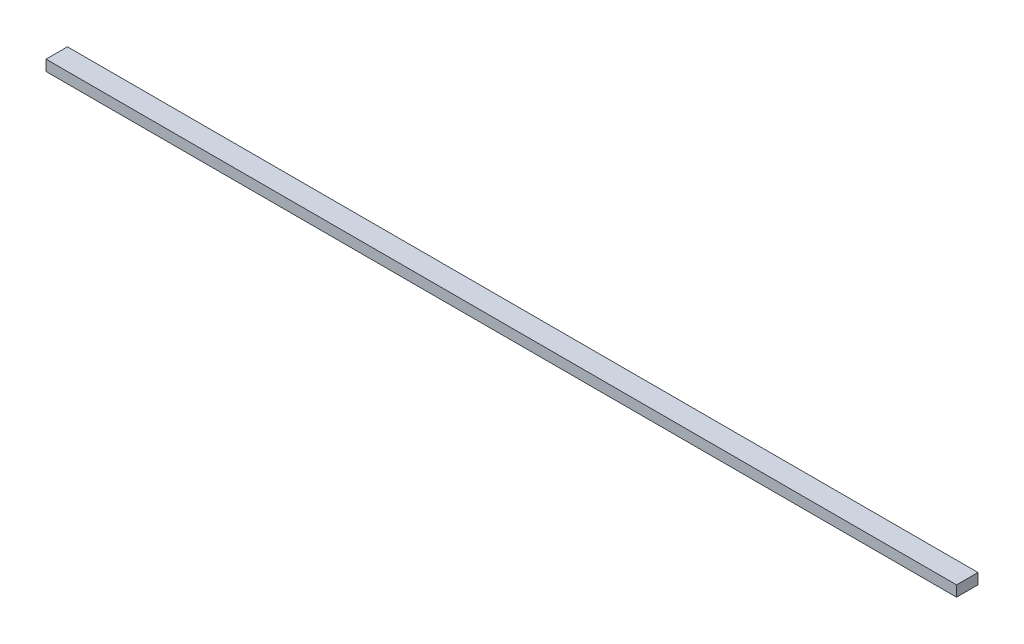
from build123d import *

# Parameters (mm, degrees)
CROQUIS1_W              = 3400
CROQUIS1_H              = 40
SALIENTE_EXTRUIR1_DEPTH = 80
CROQUIS2_W              = 70.726899914
CROQUIS2_H              = 30.836055435
SALIENTE_EXTRUIR2_DEPTH = 3400
CROQUIS3_W              = 62.144796725
CROQUIS3_H              = 26.738647853
SALIENTE_EXTRUIR4_DEPTH = 3400


with BuildPart() as part:
    # Croquis1 → Saliente-Extruir1 (new body)
    with BuildSketch(Plane.XY):
        with Locations((1541.746970888, 8.058487021)):
            Rectangle(CROQUIS1_W, CROQUIS1_H)
    extrude(amount=SALIENTE_EXTRUIR1_DEPTH)

    # Croquis2 → Saliente-Extruir2 (add)
    with BuildSketch(Plane.ZY.offset(158.253029112)):
        with Locations((41.19205332, 7.663036553)):
            Rectangle(CROQUIS2_W, CROQUIS2_H)
    extrude(amount=-SALIENTE_EXTRUIR2_DEPTH)

    # Croquis3 → Saliente-Extruir4 (add)
    with BuildSketch(Plane(origin=(3241.746970888, 0, 0), x_dir=(0, 0, -1), z_dir=(1, 0, 0))):
        with Locations((-38.975461985, 6.544049844)):
            Rectangle(CROQUIS3_W, CROQUIS3_H)
    extrude(amount=-SALIENTE_EXTRUIR4_DEPTH)


solid = part.part
